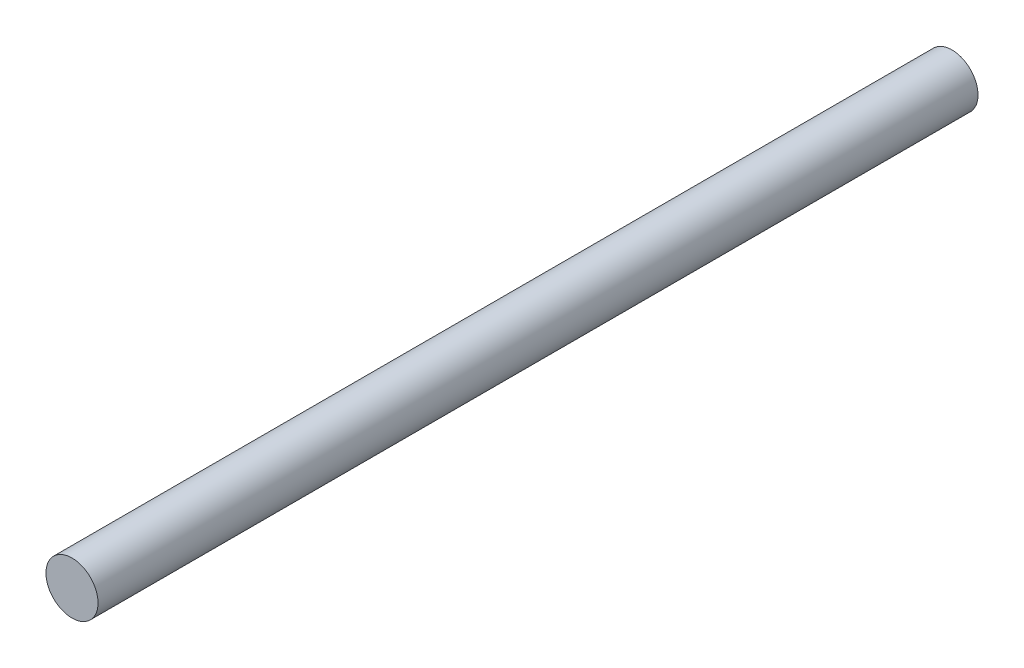
from build123d import *

# Parameters (mm, degrees)
SKETCH1_R           = 5
BOSS_EXTRUDE1_DEPTH = 169


with BuildPart() as part:
    # Sketch1 → Boss-Extrude1 (new body)
    with BuildSketch(Plane.XY):
        Circle(SKETCH1_R)
    extrude(amount=BOSS_EXTRUDE1_DEPTH)


solid = part.part
